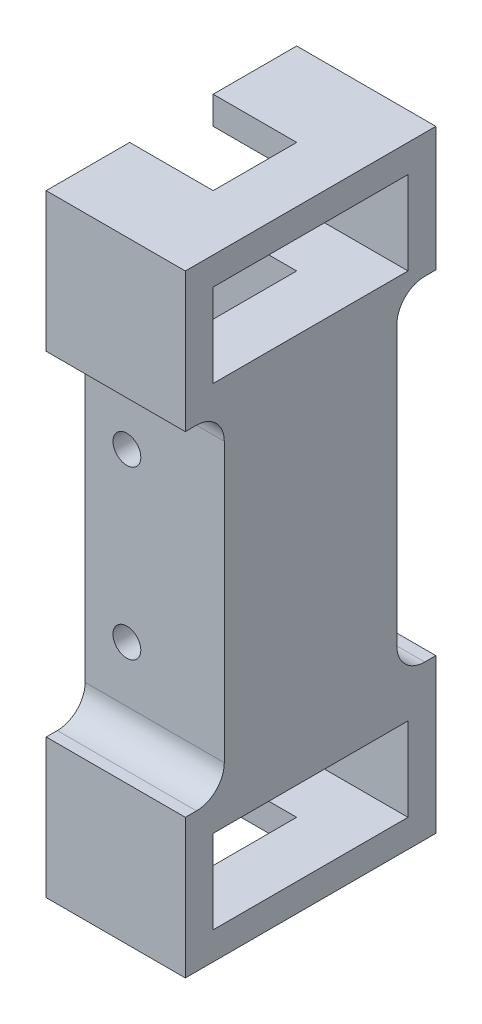
from build123d import *

# Parameters (mm, degrees)
SKETCH_1_W          = 25
SKETCH_1_H          = 45
EXTRUDE_1_DEPTH     = 110
SKETCH_2_W          = 15
SKETCH_2_H          = 15
CUT_EXTRUDE_2_DEPTH = 110
SKETCH_3_W          = 35
SKETCH_3_H          = 15
CUT_EXTRUDE_3_DEPTH = 38
SKETCH_4_W          = 7
SKETCH_4_H          = 60
CUT_EXTRUDE_4_DEPTH = 38
SKETCH_5_W          = 35
SKETCH_5_H          = 15
CUT_EXTRUDE_5_DEPTH = 38
FILLET_1_R          = 5
SKETCH_6_W          = 7
SKETCH_6_H          = 60
CUT_EXTRUDE_6_DEPTH = 38
FILLET_3_R          = 5
SKETCH_7_R          = 2.5
CUT_EXTRUDE_7_DEPTH = 40


with BuildPart() as part:
    # 草图1 → 凸台-拉伸1 (new body)
    with BuildSketch(Plane(origin=(0, 0, 0), x_dir=(1, 0, 0), z_dir=(0, 1, 0))):
        Rectangle(SKETCH_1_W, SKETCH_1_H)
    extrude(amount=EXTRUDE_1_DEPTH)

    # 草图2 → 切除-拉伸2 (cut)
    with BuildSketch(Plane(origin=(0, 110, 0), x_dir=(1, 0, 0), z_dir=(0, 1, 0))):
        with Locations((-5, 0)):
            Rectangle(SKETCH_2_W, SKETCH_2_H)
    extrude(amount=-CUT_EXTRUDE_2_DEPTH, mode=Mode.SUBTRACT)

    # 草图3 → 切除-拉伸3 (cut)
    with BuildSketch(Plane.ZY.offset(12.5)):
        with Locations((0, 12.5)):
            Rectangle(SKETCH_3_W, SKETCH_3_H)
    extrude(amount=-CUT_EXTRUDE_3_DEPTH, mode=Mode.SUBTRACT)

    # 草图4 → 切除-拉伸4 (cut)
    with BuildSketch(Plane.ZY.offset(12.5)):
        with Locations((19, 55)):
            Rectangle(SKETCH_4_W, SKETCH_4_H)
    extrude(amount=-CUT_EXTRUDE_4_DEPTH, mode=Mode.SUBTRACT)

    # 草图5 → 切除-拉伸5 (cut)
    with BuildSketch(Plane.ZY.offset(12.5)):
        with Locations((0, 97.5)):
            Rectangle(SKETCH_5_W, SKETCH_5_H)
    extrude(amount=-CUT_EXTRUDE_5_DEPTH, mode=Mode.SUBTRACT)

    # 圆角1
    fillet_1_edges = [part.edges().sort_by_distance(p)[0] for p in [
        (0, 25, 15.5),
        (0, 85, 15.5),
    ]]
    fillet(fillet_1_edges, radius=FILLET_1_R)

    # 草图6 → 切除-拉伸6 (cut)
    with BuildSketch(Plane.ZY.offset(12.5)):
        with Locations((-19, 57.659101088)):
            Rectangle(SKETCH_6_W, SKETCH_6_H)
    extrude(amount=-CUT_EXTRUDE_6_DEPTH, mode=Mode.SUBTRACT)

    # 圆角3
    fillet_3_edges = [part.edges().sort_by_distance(p)[0] for p in [
        (0, 87.659101088, -15.5),
        (0, 27.659101088, -15.5),
    ]]
    fillet(fillet_3_edges, radius=FILLET_3_R)

    # 草图7 → 切除-拉伸7 (cut)
    with BuildSketch(Plane(origin=(0, 0, -15.5), x_dir=(-1, 0, 0), z_dir=(0, 0, -1))):
        with Locations((5, 40)):
            Circle(SKETCH_7_R)
        with Locations((5, 70)):
            Circle(SKETCH_7_R)
    extrude(amount=-CUT_EXTRUDE_7_DEPTH, mode=Mode.SUBTRACT)


solid = part.part
